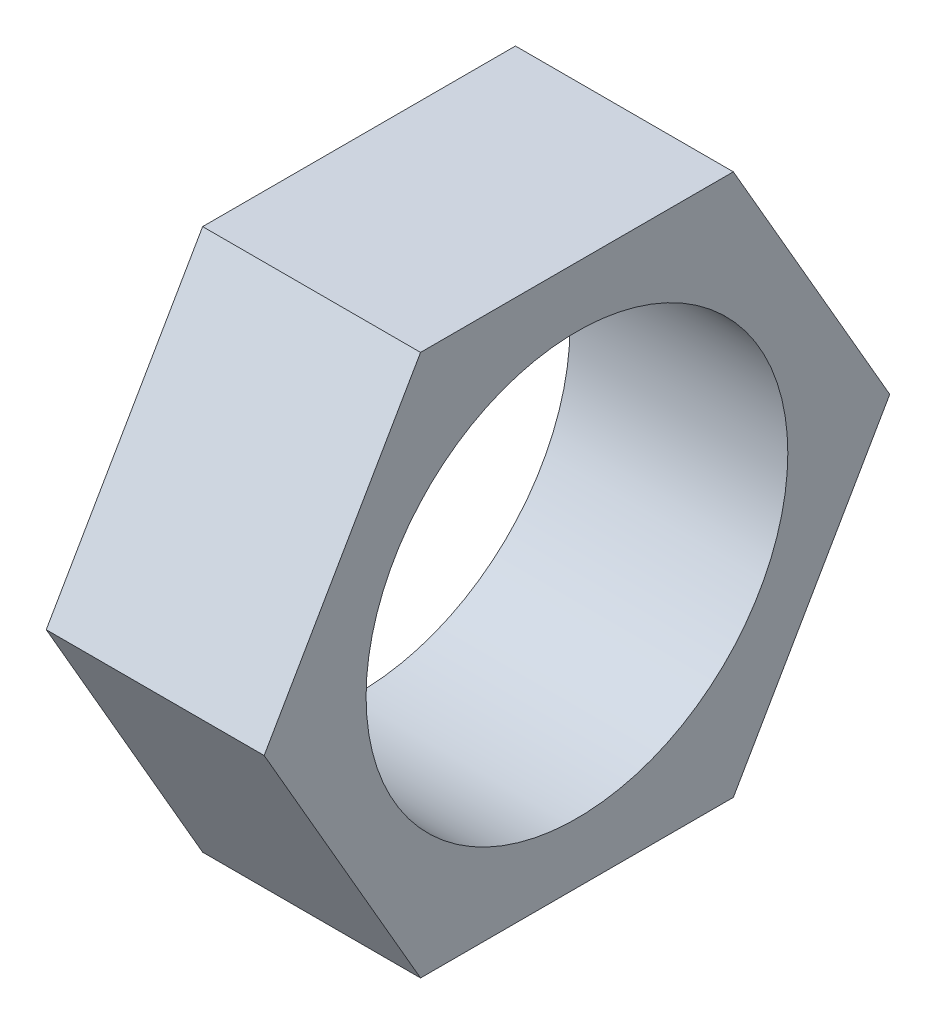
from build123d import *

# Parameters (mm, degrees)
EXTRUDE_1_DEPTH     = 3.1
SKETCH_2_R          = 3
CUT_EXTRUDE_1_DEPTH = 7.653147751


with BuildPart() as part:
    # 草图1 → 凸台-拉伸1 (new body)
    with BuildSketch(Plane(origin=(0, 0, 0), x_dir=(0, 0, -1), z_dir=(1, 0, 0))):
        Polygon((4.45, 0), (2.225, 3.853813047), (-2.225, 3.853813047), (-4.45, 0), (-2.225, -3.853813047), (2.225, -3.853813047), align=None)
    extrude(amount=EXTRUDE_1_DEPTH)

    # 草图2 → 切除-拉伸1 (cut, through all)
    with BuildSketch(Plane(origin=(3.1, 0, 0), x_dir=(0, 0, -1), z_dir=(1, 0, 0))):
        Circle(SKETCH_2_R)
    extrude(amount=-CUT_EXTRUDE_1_DEPTH, mode=Mode.SUBTRACT)


solid = part.part
